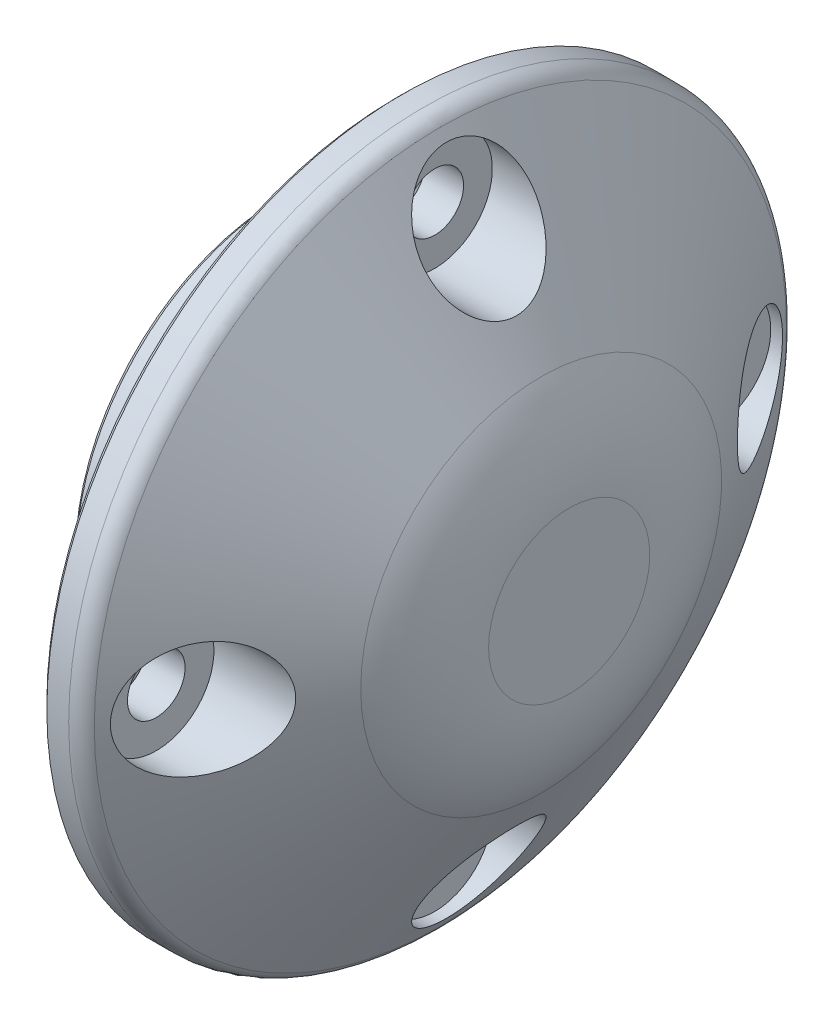
from build123d import *

# Parameters (mm, degrees)
FILLET2_R          = 1
CHAMFER1_SIZE      = 0.3
SKETCH2_R          = 1.5
CUT_EXTRUDE1_DEPTH = 10
SKETCH3_R          = 3
CUT_EXTRUDE2_DEPTH = 10


with BuildPart() as part:
    # Sketch1 → Revolve1 (revolve)
    with BuildSketch(Plane.XY, mode=Mode.PRIVATE) as revolve1_sk:
        with BuildLine():
            Line((-6, 9), (-6, 11))
            Line((-6, 11), (0, 11))
            Line((0, 11), (0, 18.5))
            Line((0, 18.5), (1.438007651, 18.5))
            ThreePointArc((1.438007651, 18.5), (1.927932672, 18.371764575), (2.292206206, 18.019946947))
            Line((2.292206206, 18.019946947), (7.541985556, 9.395309443))
            ThreePointArc((7.541985556, 9.395309443), (8.628599471, 6.895853348), (9, 4.195839975))
            Line((9, 4.195839975), (9, 0))
            Line((9, 0), (2, 0))
            Line((2, 0), (2, 9))
            Line((2, 9), (-6, 9))
        make_face()
    revolve(revolve1_sk.sketch.rotate(Axis((0, 0, 0), (1, 0, 0)), 90), axis=Axis((0, 0, 0), (1, 0, 0)))

    # Fillet2
    fillet2_edges = [part.edges().sort_by_distance(p)[0] for p in [
        (0, 0, -11),
        (2, 0, -9),
    ]]
    fillet(fillet2_edges, radius=FILLET2_R)

    # Chamfer1
    chamfer1_edges = [part.edges().sort_by_distance(p)[0] for p in [
        (0, 0, -18.5),
        (-6, 0, -11),
    ]]
    chamfer(chamfer1_edges, length=CHAMFER1_SIZE)

    # Sketch2 → Cut-Extrude1 (cut)
    with BuildSketch(Plane.ZY):
        with Locations((0, 14.5)):
            Circle(SKETCH2_R)
        with Locations((14.5, 0)):
            Circle(SKETCH2_R)
        with Locations((0, -14.5)):
            Circle(SKETCH2_R)
        with Locations((-14.5, 0)):
            Circle(SKETCH2_R)
    extrude(amount=-CUT_EXTRUDE1_DEPTH, mode=Mode.SUBTRACT)

    # Sketch3 → Cut-Extrude2 (cut)
    with BuildSketch(Plane.ZY.offset(-2)):
        with Locations((0, 14.5)):
            Circle(SKETCH3_R)
        with Locations((14.5, 0)):
            Circle(SKETCH3_R)
        with Locations((0, -14.5)):
            Circle(SKETCH3_R)
        with Locations((-14.5, 0)):
            Circle(SKETCH3_R)
    extrude(amount=-CUT_EXTRUDE2_DEPTH, mode=Mode.SUBTRACT)


solid = part.part
